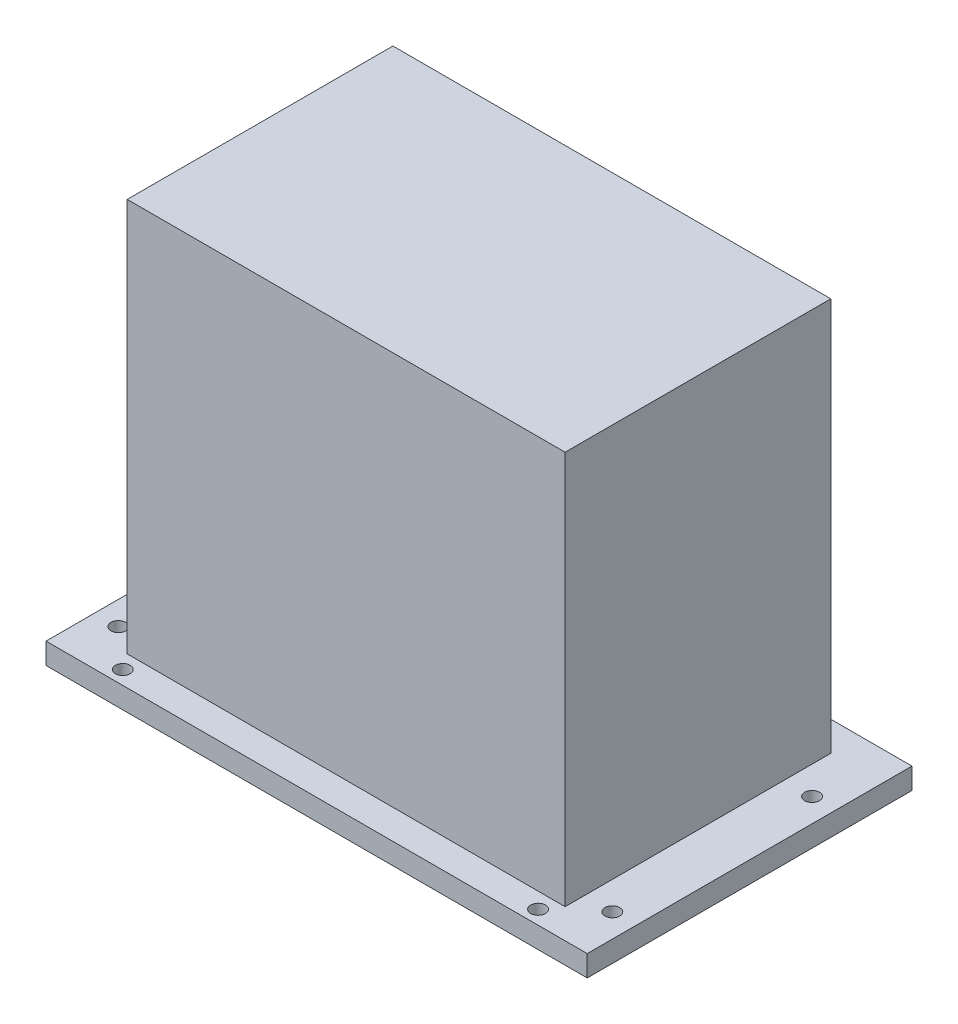
from build123d import *

# Parameters (mm, degrees)
SKETCH1_R           = 1.5
BOSS_EXTRUDE1_DEPTH = 4.3
SKETCH2_W           = 89
SKETCH2_H           = 54
BOSS_EXTRUDE2_DEPTH = 80


with BuildPart() as part:
    # Sketch1 → Boss-Extrude1 (new body)
    with BuildSketch(Plane(origin=(0, 0, 0), x_dir=(1, 0, 0), z_dir=(0, 1, 0))):
        Polygon((-35.5, 27), (-35.5, 33), (-55, 33), (-55, -33), (55, -33), (55, 33), (35.5, 33), (35.5, 27), (15.5, 27), (15.5, 33), (-15.5, 33), (-15.5, 27), align=None)
        with Locations(Location((-42.2, -30.2, 0), (0, 0, 90))):
            Circle(SKETCH1_R, mode=Mode.SUBTRACT)
        with Locations(Location((-50.2, -23.1, 0), (0, 0, 90))):
            Circle(SKETCH1_R, mode=Mode.SUBTRACT)
        with Locations(Location((-42.2, -24.2, 0), (0, 0, 90))):
            Circle(SKETCH1_R, mode=Mode.SUBTRACT)
        with Locations(Location((42.2, -30.2, 0), (0, 0, 90))):
            Circle(SKETCH1_R, mode=Mode.SUBTRACT)
        with Locations(Location((42.2, -24.2, 0), (0, 0, 90))):
            Circle(SKETCH1_R, mode=Mode.SUBTRACT)
        with Locations(Location((50.2, -23.1, 0), (0, 0, 90))):
            Circle(SKETCH1_R, mode=Mode.SUBTRACT)
        with Locations(Location((-50.2, 17.5, 0), (0, 0, 90))):
            Circle(SKETCH1_R, mode=Mode.SUBTRACT)
        with Locations(Location((-42.2, 18.5, 0), (0, 0, 90))):
            Circle(SKETCH1_R, mode=Mode.SUBTRACT)
        with Locations(Location((-42.2, 24.5, 0), (0, 0, 90))):
            Circle(SKETCH1_R, mode=Mode.SUBTRACT)
        with Locations(Location((42.2, 18.5, 0), (0, 0, 90))):
            Circle(SKETCH1_R, mode=Mode.SUBTRACT)
        with Locations(Location((50.2, 17.5, 0), (0, 0, 90))):
            Circle(SKETCH1_R, mode=Mode.SUBTRACT)
        with Locations(Location((42.2, 24.5, 0), (0, 0, 90))):
            Circle(SKETCH1_R, mode=Mode.SUBTRACT)
    extrude(amount=BOSS_EXTRUDE1_DEPTH)

    # Sketch2 → Boss-Extrude2 (add)
    with BuildSketch(Plane(origin=(0, 4.3, 0), x_dir=(1, 0, 0), z_dir=(0, 1, 0))):
        Rectangle(SKETCH2_W, SKETCH2_H)
    extrude(amount=BOSS_EXTRUDE2_DEPTH)


solid = part.part
